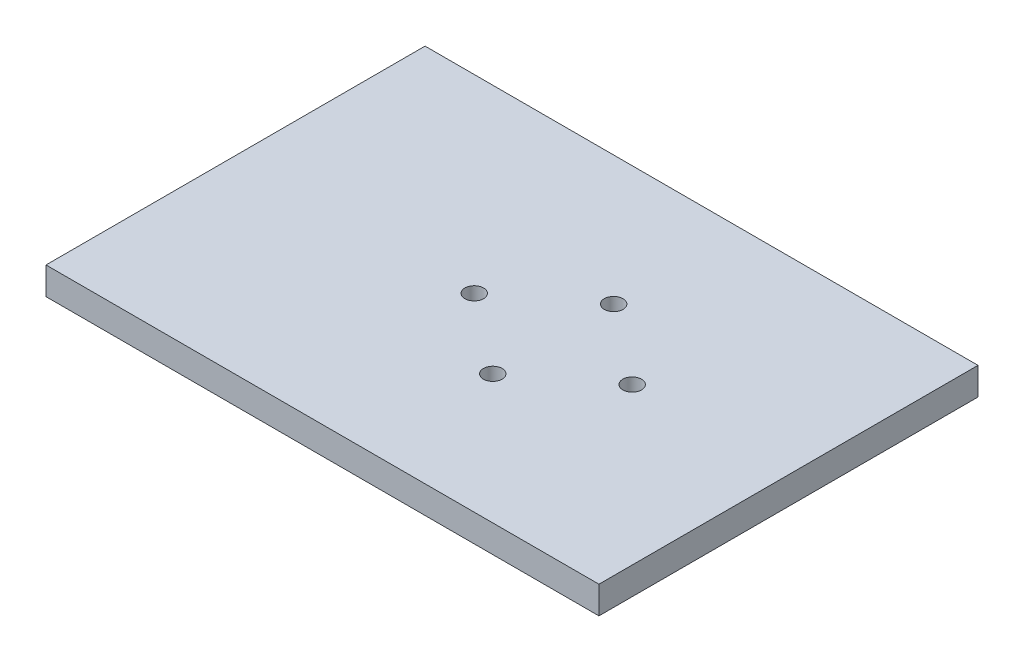
from build123d import *

# Parameters (mm, degrees)
SKETCH1_W           = 100.65
SKETCH1_H           = 69
SKETCH1_R           = 1.7
BOSS_EXTRUDE1_DEPTH = 5


with BuildPart() as part:
    # Sketch1 → Boss-Extrude1 (new body)
    with BuildSketch(Plane(origin=(0, 0, 0), x_dir=(1, 0, 0), z_dir=(0, 1, 0))):
        with Locations((-7.5, 0)):
            Rectangle(SKETCH1_W, SKETCH1_H)
        with Locations(Location((0, 11, 0), (0, 0, 270))):
            Circle(SKETCH1_R, mode=Mode.SUBTRACT)
        with Locations(Location((-14.375, 0, 0), (0, 0, 270))):
            Circle(SKETCH1_R, mode=Mode.SUBTRACT)
        with Locations(Location((0, -11, 0), (0, 0, 90))):
            Circle(SKETCH1_R, mode=Mode.SUBTRACT)
        with Locations(Location((14.375, 0, 0), (0, 0, 90))):
            Circle(SKETCH1_R, mode=Mode.SUBTRACT)
    extrude(amount=BOSS_EXTRUDE1_DEPTH)


solid = part.part
